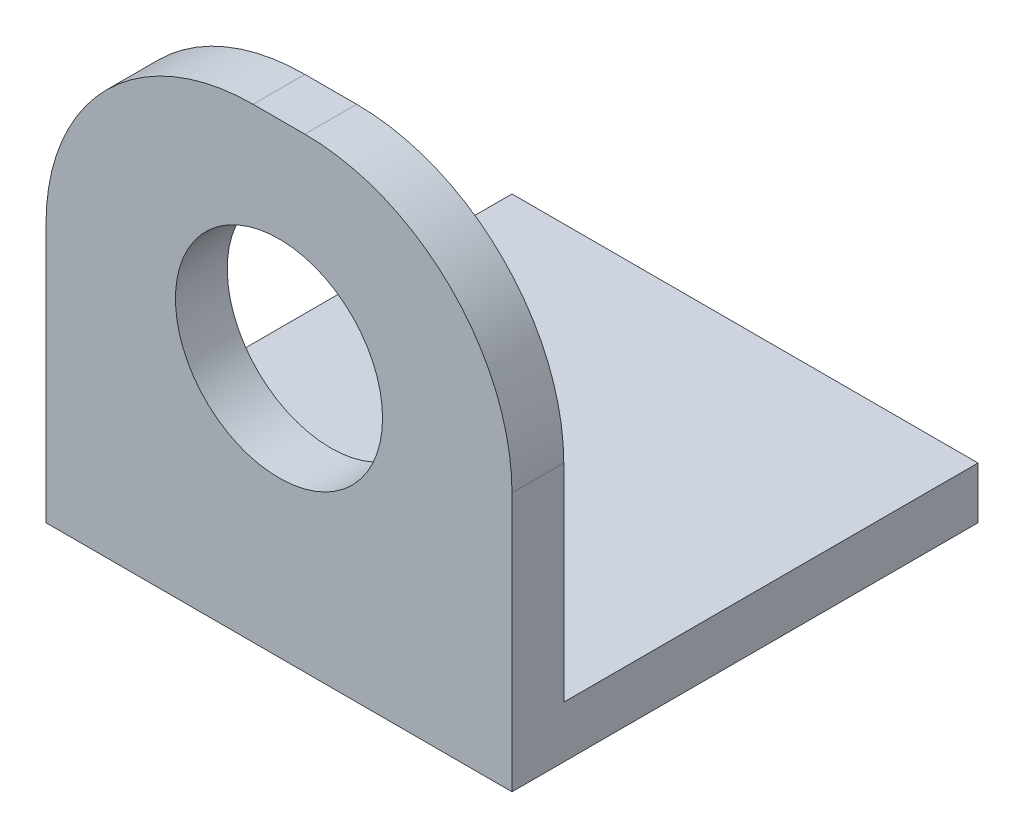
from build123d import *

# Parameters (mm, degrees)
BOSS_EXTRUDE1_DEPTH = 9
SKETCH2_R           = 2
CUT_EXTRUDE1_DEPTH  = 10
FILLET1_R           = 4


with BuildPart() as part:
    # Sketch1 → Boss-Extrude1 (new body)
    with BuildSketch(Plane(origin=(0, 0, 0), x_dir=(0, 0, -1), z_dir=(1, 0, 0))):
        Polygon((-1, 8), (-1, -1), (8, -1), (8, 0), (0, 0), (0, 8), align=None)
    extrude(amount=BOSS_EXTRUDE1_DEPTH)

    # Sketch2 → Cut-Extrude1 (cut)
    with BuildSketch(Plane.XY.offset(1)):
        with Locations((4.5, 4)):
            Circle(SKETCH2_R)
    extrude(amount=-CUT_EXTRUDE1_DEPTH, mode=Mode.SUBTRACT)

    # Fillet1
    fillet1_edges = [part.edges().sort_by_distance(p)[0] for p in [
        (9, 8, 0.5),
        (0, 8, 0.5),
    ]]
    fillet(fillet1_edges, radius=FILLET1_R)


solid = part.part
